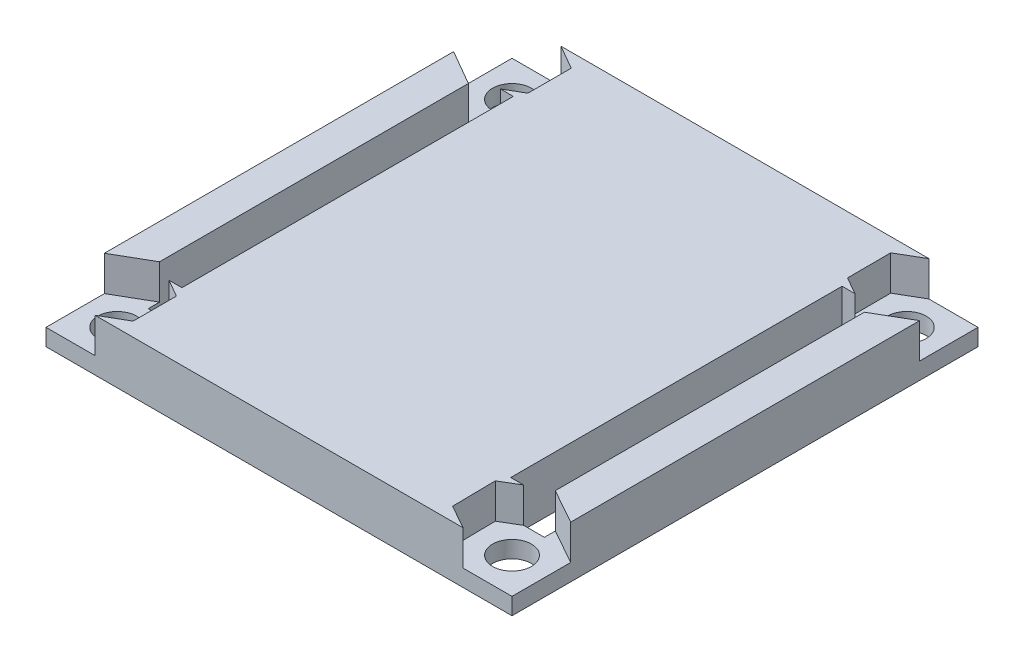
from build123d import *

# Parameters (mm, degrees)
SKETCH1_W           = 36
SKETCH1_H           = 36
BOSS_EXTRUDE1_DEPTH = 4
SKETCH2_R           = 1.5
CUT_EXTRUDE1_DEPTH  = 26.768197453
CUT_EXTRUDE3_DEPTH  = 2.7
CUT_EXTRUDE4_REACH  = 27.768
SKETCH4_W           = 2.6
SKETCH4_H           = 25.6


with BuildPart() as part:
    # Sketch1 → Boss-Extrude1 (new body)
    with BuildSketch(Plane(origin=(0, 0, 0), x_dir=(1, 0, 0), z_dir=(0, 1, 0))):
        Rectangle(SKETCH1_W, SKETCH1_H)
    extrude(amount=BOSS_EXTRUDE1_DEPTH)

    # Sketch2 → Cut-Extrude1 (cut, through all)
    with BuildSketch(Plane(origin=(0, 4, 0), x_dir=(1, 0, 0), z_dir=(0, 1, 0))):
        with Locations(Location((-15.25, 15.25, 0), (0, 0, 270))):
            Circle(SKETCH2_R)
        with Locations(Location((15.25, 15.25, 0), (0, 0, 270))):
            Circle(SKETCH2_R)
        with Locations(Location((15.25, -15.25, 0), (0, 0, 270))):
            Circle(SKETCH2_R)
        with Locations(Location((-15.25, -15.25, 0), (0, 0, 270))):
            Circle(SKETCH2_R)
    extrude(amount=-CUT_EXTRUDE1_DEPTH, mode=Mode.SUBTRACT)

    # Sketch3 → Cut-Extrude3 (cut)
    with BuildSketch(Plane(origin=(0, 4, 0), x_dir=(1, 0, 0), z_dir=(0, 1, 0))):
        Polygon((-15.25, 11.901368439), (-12.35, 13.575684219), (-12.35, 16.924315781), (-15.25, 18.598631561), (-18.15, 18.598631561), (-18.15, 16.924315781), (-18.15, 13.575684219), align=None)
        Polygon((15.26270162, 11.901392528), (18.156329948, 13.58669619), (18.143628328, 16.935303662), (18.143628328, 18.598607472), (15.23729838, 18.598607472), (12.343670052, 16.91330381), (12.356371672, 13.564696338), align=None)
        Polygon((18.17418246, -16.881713907), (18.125196925, -13.533440657), (15.201014465, -11.901726751), (12.32581754, -13.618286093), (12.374803075, -16.966559343), (15.298985535, -18.598273249), (18.17418246, -18.598273249), align=None)
        Polygon((-15.25, -18.598631561), (-12.35, -16.924315781), (-12.35, -13.575684219), (-15.25, -11.901368439), (-18.15, -13.575684219), (-18.15, -16.924315781), (-18.15, -18.598631561), align=None)
    extrude(amount=-CUT_EXTRUDE3_DEPTH, mode=Mode.SUBTRACT)

    # Sketch4 → Cut-Extrude4 (cut, up to next)
    with BuildSketch(Plane.XZ, mode=Mode.PRIVATE) as cut_extrude4_sk1:
        with Locations((-14, 0)):
            Rectangle(SKETCH4_W, SKETCH4_H)
    cut_extrude4_tool1 = extrude(cut_extrude4_sk1.sketch, amount=-CUT_EXTRUDE4_REACH, mode=Mode.PRIVATE) & part.part
    # Sketch4 → Cut-Extrude4 (cut, up to next)
    with BuildSketch(Plane.XZ, mode=Mode.PRIVATE) as cut_extrude4_sk2:
        with Locations((14, 0)):
            Rectangle(SKETCH4_W, SKETCH4_H)
    cut_extrude4_tool2 = extrude(cut_extrude4_sk2.sketch, amount=-CUT_EXTRUDE4_REACH, mode=Mode.PRIVATE) & part.part
    add(cut_extrude4_tool1.solids().sort_by_distance((-14, 0, 0))[0], mode=Mode.SUBTRACT)
    add(cut_extrude4_tool2.solids().sort_by_distance((14, 0, 0))[0], mode=Mode.SUBTRACT)


solid = part.part
